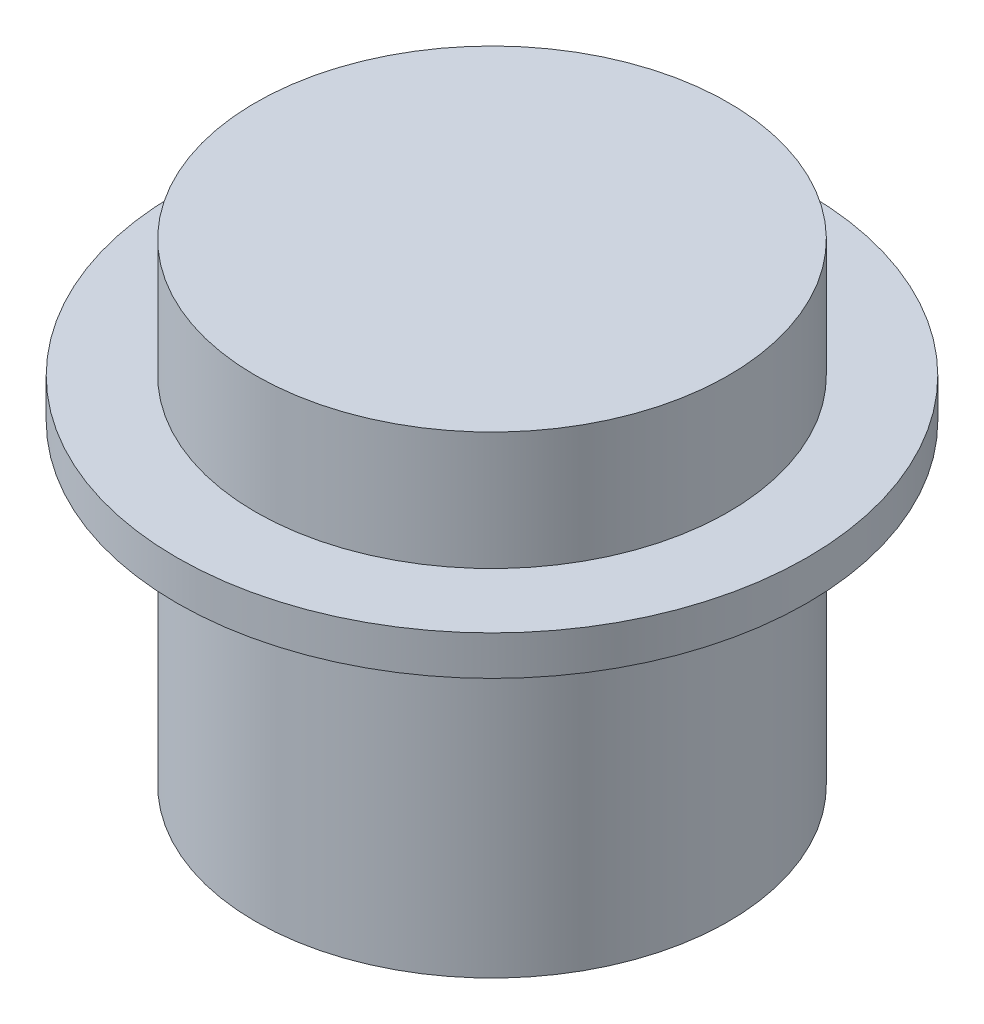
from build123d import *

# Parameters (mm, degrees)
BOSS_EXTRUDE1_DEPTH      = 25.4
BOSS_EXTRUDE1_DEPTH_BACK = 50.8
SKETCH1_R                = 38.1
SKETCH1_3_R              = 50.8
SKETCH1_3_R_2            = 38.1
BOSS_EXTRUDE2_DEPTH      = 6.35


with BuildPart() as part:
    # Sketch1 → Boss-Extrude1 (new, two sides: drawn at the far end of the back side and taken through both)
    with BuildSketch(Plane(origin=(0, 0, 0), x_dir=(1, 0, 0), z_dir=(0, 1, 0)).offset(-BOSS_EXTRUDE1_DEPTH_BACK)):
        Circle(SKETCH1_R)
    extrude(amount=BOSS_EXTRUDE1_DEPTH + BOSS_EXTRUDE1_DEPTH_BACK)

    # Sketch1<3> → Boss-Extrude2 (add)
    with BuildSketch(Plane(origin=(0, 0, 0), x_dir=(1, 0, 0), z_dir=(0, 1, 0))):
        Circle(SKETCH1_3_R)
        Circle(SKETCH1_3_R_2, mode=Mode.SUBTRACT)
    extrude(amount=BOSS_EXTRUDE2_DEPTH)


solid = part.part
